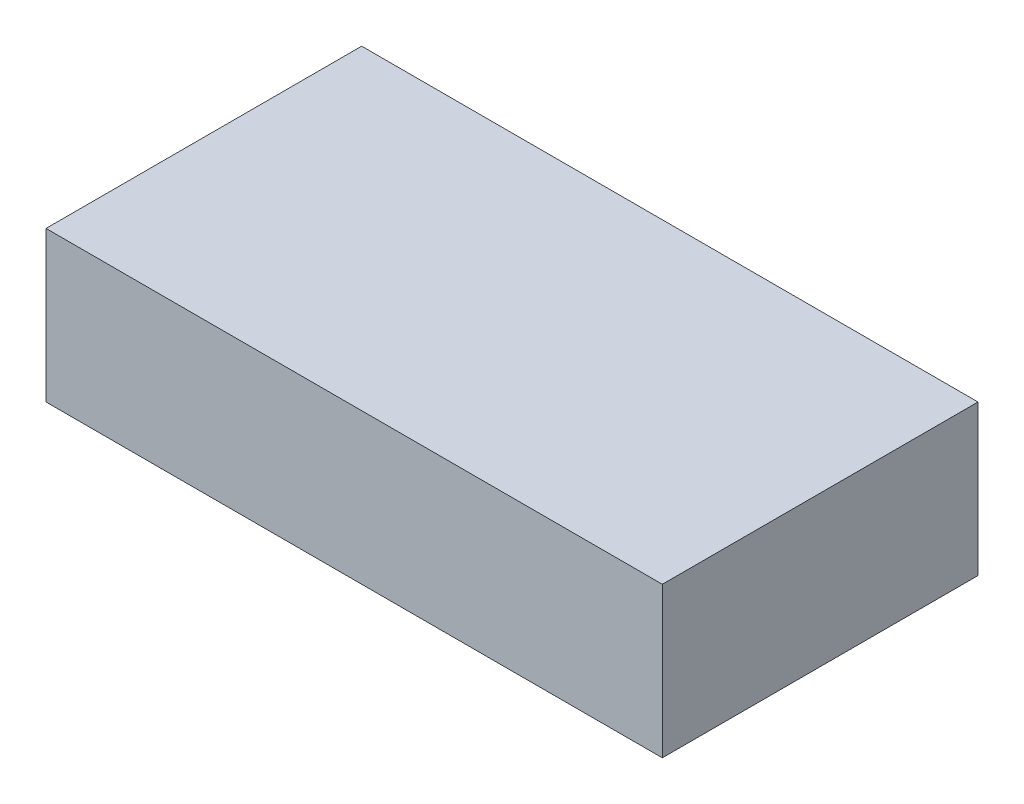
from build123d import *

# Parameters (mm, degrees)
SKETCH1_W           = 41
SKETCH1_H           = 21
BOSS_EXTRUDE1_DEPTH = 10


with BuildPart() as part:
    # Sketch1 → Boss-Extrude1 (new body)
    with BuildSketch(Plane(origin=(0, 0, 0), x_dir=(1, 0, 0), z_dir=(0, 1, 0))):
        with Locations((20.5, 10.5)):
            Rectangle(SKETCH1_W, SKETCH1_H)
    extrude(amount=BOSS_EXTRUDE1_DEPTH)


solid = part.part
